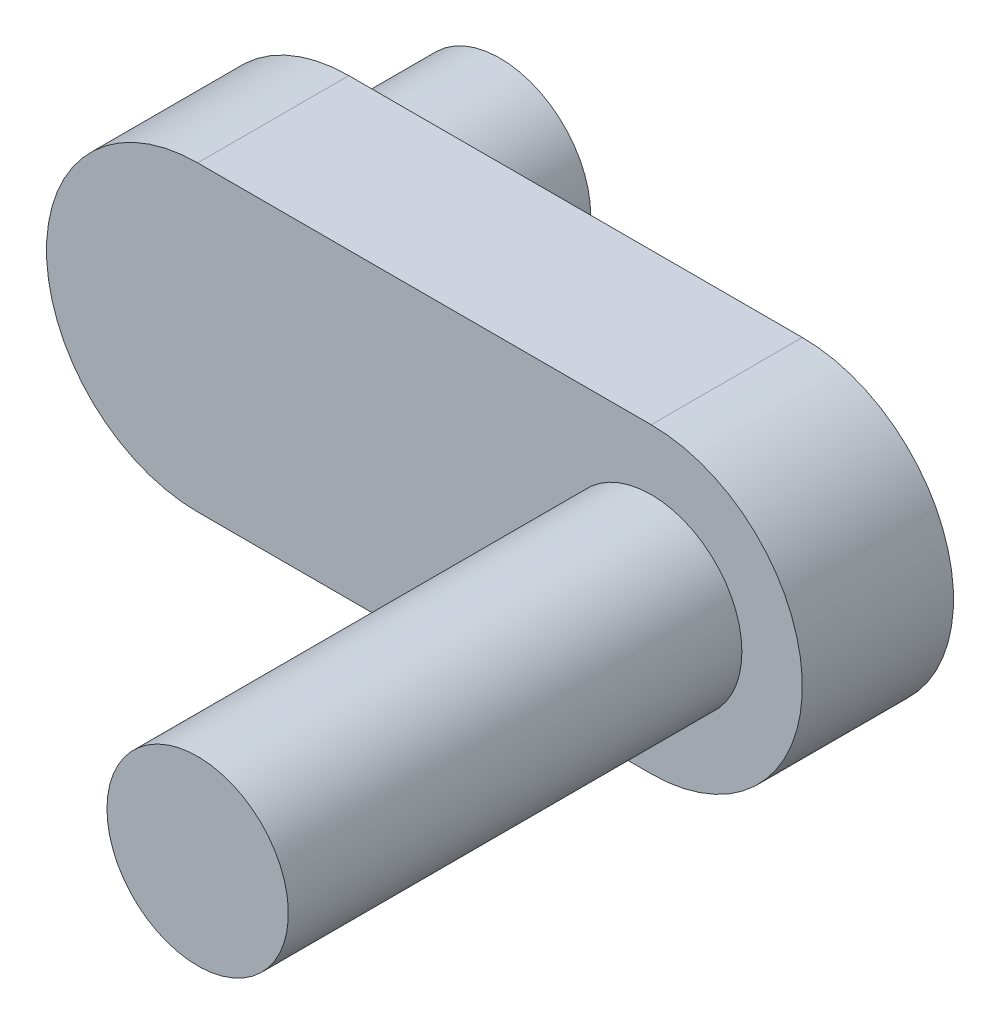
from build123d import *

# Parameters (mm, degrees)
SKETCH1_R           = 3
BOSS_EXTRUDE1_DEPTH = 5
BOSS_EXTRUDE2_START = -10
SKETCH2_R           = 3
BOSS_EXTRUDE2_DEPTH = 10
SKETCH3_R           = 3
BOSS_EXTRUDE3_DEPTH = 20


with BuildPart() as part:
    # Sketch1 → Boss-Extrude1 (new body)
    with BuildSketch(Plane.XY):
        with BuildLine():
            Line((7.5, -5), (-7.5, -5))
            ThreePointArc((-7.5, -5), (-12.5, 0), (-7.5, 5))
            Line((-7.5, 5), (7.5, 5))
            ThreePointArc((7.5, 5), (12.5, 0), (7.5, -5))
        make_face()
        with Locations((-7.5, 0)):
            Circle(SKETCH1_R, mode=Mode.SUBTRACT)
        with Locations((7.5, 0)):
            Circle(SKETCH1_R, mode=Mode.SUBTRACT)
    extrude(amount=BOSS_EXTRUDE1_DEPTH)

    # Sketch2 → Boss-Extrude2 (add)
    with BuildSketch(Plane.XY.offset(5).offset(BOSS_EXTRUDE2_START)):
        with Locations((-7.5, 0)):
            Circle(SKETCH2_R)
    extrude(amount=BOSS_EXTRUDE2_DEPTH)

    # Sketch3 → Boss-Extrude3 (add)
    with BuildSketch(Plane(origin=(0, 0, 0), x_dir=(-1, 0, 0), z_dir=(0, 0, -1))):
        with Locations((-7.5, 0)):
            Circle(SKETCH3_R)
    extrude(amount=-BOSS_EXTRUDE3_DEPTH)


solid = part.part
